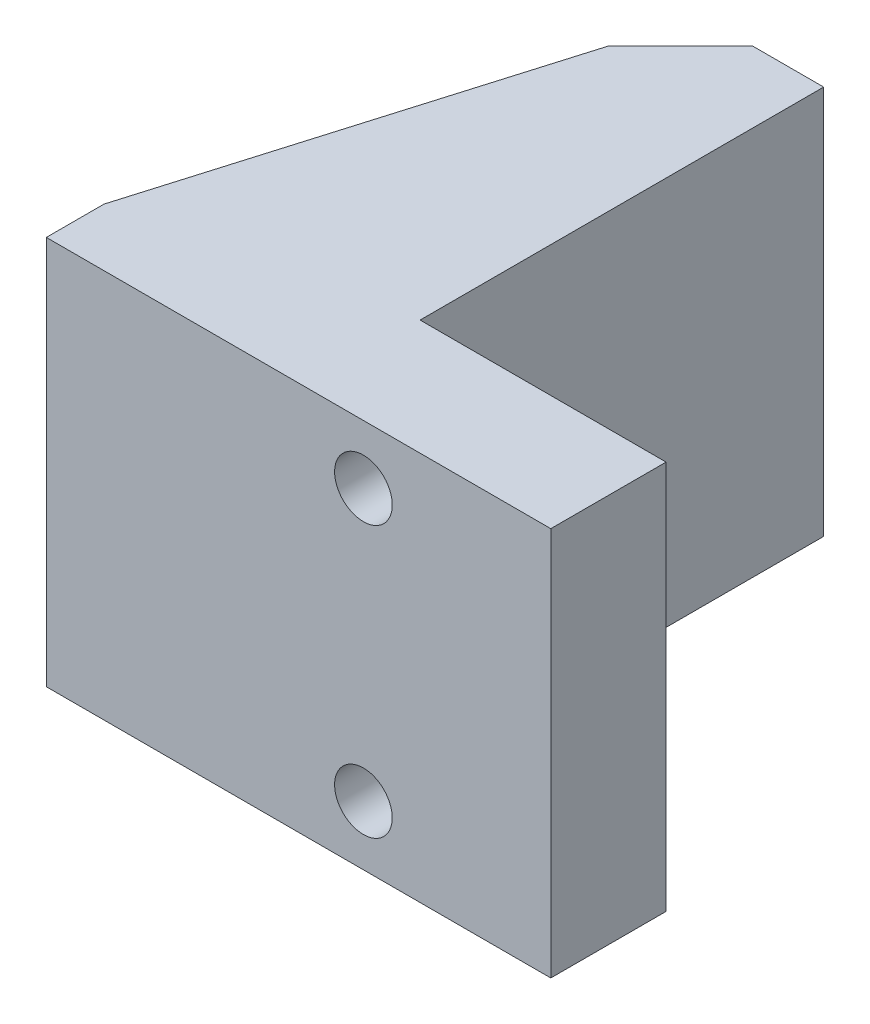
from build123d import *

# Parameters (mm, degrees)
SKETCH1_W           = 17.145
SKETCH1_H           = 17.145
BOSS_EXTRUDE1_DEPTH = 5.08
SKETCH2_R           = 1.27
CUT_EXTRUDE1_DEPTH  = 25.773139688
SKETCH3_R           = 2.54
CUT_EXTRUDE4_DEPTH  = 2.54
SKETCH4_W           = 6.307704678
SKETCH4_H           = 17.145
BOSS_EXTRUDE2_DEPTH = 17.78
SKETCH5_W           = 2.54
SKETCH5_H           = 17.145
BOSS_EXTRUDE3_DEPTH = 5.08
CHAMFER1_SIZE       = 3.175
BOSS_EXTRUDE4_DEPTH = 2.54
BOSS_EXTRUDE5_DEPTH = 2.54


with BuildPart() as part:
    # Sketch1 → Boss-Extrude1 (new body)
    with BuildSketch(Plane.XY):
        with Locations((8.5725, -8.5725)):
            Rectangle(SKETCH1_W, SKETCH1_H)
    extrude(amount=BOSS_EXTRUDE1_DEPTH)

    # Sketch2 → Cut-Extrude1 (cut, through all)
    with BuildSketch(Plane(origin=(0, 0, 0), x_dir=(-1, 0, 0), z_dir=(0, 0, -1))):
        with Locations((-8.89, -2.5908)):
            Circle(SKETCH2_R)
        with Locations((-8.89, -14.5288)):
            Circle(SKETCH2_R)
    extrude(amount=-CUT_EXTRUDE1_DEPTH, mode=Mode.SUBTRACT)

    # Sketch3 → Cut-Extrude4 (cut)
    with BuildSketch(Plane(origin=(0, 0, 0), x_dir=(-1, 0, 0), z_dir=(0, 0, -1))):
        with Locations((-8.89, -2.5908)):
            Circle(SKETCH3_R)
        with Locations((-8.89, -14.5288)):
            Circle(SKETCH3_R)
    extrude(amount=-CUT_EXTRUDE4_DEPTH, mode=Mode.SUBTRACT)

    # Sketch4 → Boss-Extrude2 (add)
    with BuildSketch(Plane(origin=(0, 0, 0), x_dir=(-1, 0, 0), z_dir=(0, 0, -1))):
        with Locations((-3.153852339, -8.5725)):
            Rectangle(SKETCH4_W, SKETCH4_H)
    extrude(amount=BOSS_EXTRUDE2_DEPTH)

    # Sketch5 → Boss-Extrude3 (add)
    with BuildSketch(Plane.ZY):
        with Locations((3.81, -8.5725)):
            Rectangle(SKETCH5_W, SKETCH5_H)
    extrude(amount=BOSS_EXTRUDE3_DEPTH)

    # Chamfer1
    chamfer1_edges = [part.edges().sort_by_distance(p)[0] for p in [
        (0, -8.5725, -17.78),
    ]]
    chamfer(chamfer1_edges, length=CHAMFER1_SIZE)

    # Sketch7 → Boss-Extrude4 (add)
    with BuildSketch(Plane(origin=(0, 0, 0), x_dir=(1, 0, 0), z_dir=(0, 1, 0))):
        Polygon((-5.08, -2.54), (0, 14.605), (0, -2.54), align=None)
    extrude(amount=-BOSS_EXTRUDE4_DEPTH)

    # Sketch8 → Boss-Extrude5 (add)
    with BuildSketch(Plane.XZ.offset(17.145)):
        Polygon((0, 2.54), (-5.08, 2.54), (0, -14.605), align=None)
    extrude(amount=-BOSS_EXTRUDE5_DEPTH)


solid = part.part
